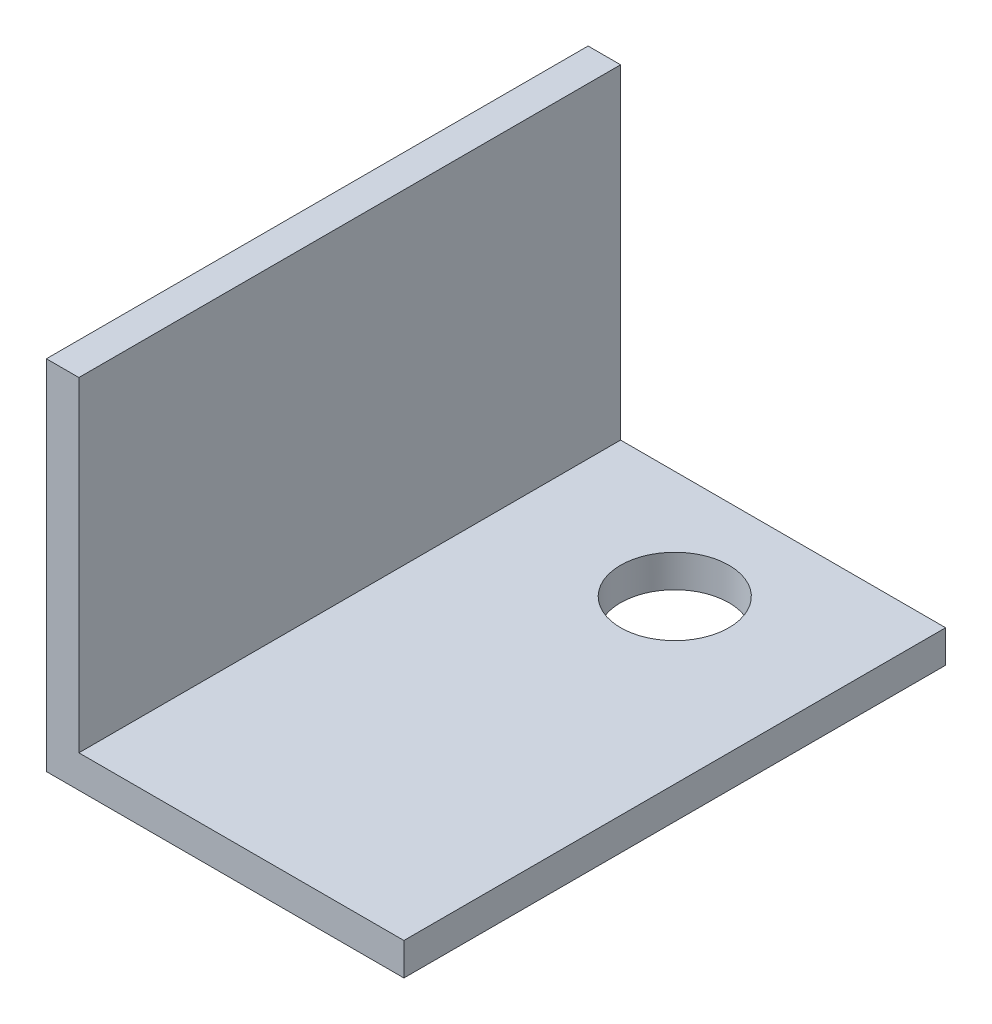
from build123d import *

# Parameters (mm, degrees)
EXTRUDE_1_DEPTH     = 50
SKETCH_2_R          = 5
CUT_EXTRUDE_1_DEPTH = 10


with BuildPart() as part:
    # Эскиз1 → Вытянуть-Тонкостенный1 (new body)
    with BuildSketch(Plane.XY):
        Polygon((0, 30), (0, 0), (30, 0), (30, -3), (-3, -3), (-3, 30), align=None)
    extrude(amount=-EXTRUDE_1_DEPTH)

    # Эскиз2 → Вырез-Вытянуть1 (cut)
    with BuildSketch(Plane.ZX.offset(-3)):
        with Locations(Location((-40, 15, 0), (0, 0, 180))):
            Circle(SKETCH_2_R)
    extrude(amount=CUT_EXTRUDE_1_DEPTH, mode=Mode.SUBTRACT)


solid = part.part
